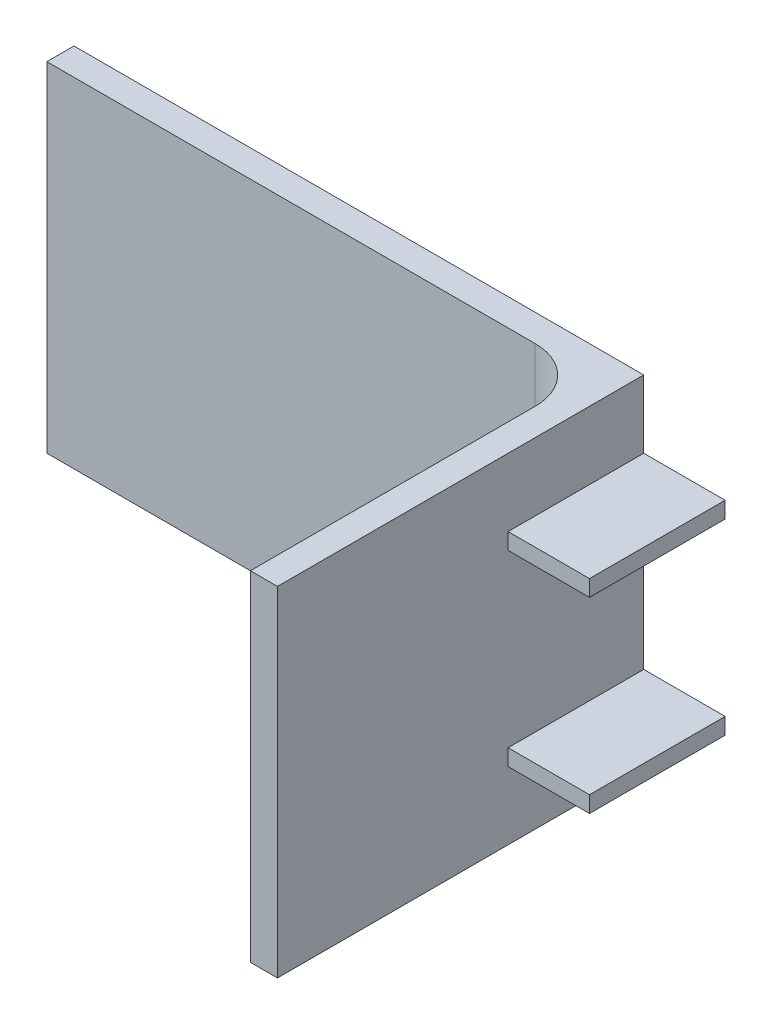
from build123d import *

# Parameters (mm, degrees)
SKETCH1_W           = 42
SKETCH1_H           = 25
BOSS_EXTRUDE1_DEPTH = 2
SKETCH2_W           = 2
SKETCH2_H           = 25
BOSS_EXTRUDE2_DEPTH = 25
SKETCH3_W           = 10
SKETCH3_H           = 1.2
BOSS_EXTRUDE3_DEPTH = 6
FILLET1_R           = 4


with BuildPart() as part:
    # Sketch1 → Boss-Extrude1 (new body)
    with BuildSketch(Plane.XY):
        with Locations((-21, 12.5)):
            Rectangle(SKETCH1_W, SKETCH1_H)
    extrude(amount=BOSS_EXTRUDE1_DEPTH)

    # Sketch2 → Boss-Extrude2 (add)
    with BuildSketch(Plane.XY.offset(2)):
        with Locations((-1, 12.5)):
            Rectangle(SKETCH2_W, SKETCH2_H)
    extrude(amount=BOSS_EXTRUDE2_DEPTH)

    # Sketch3 → Boss-Extrude3 (add)
    with BuildSketch(Plane(origin=(0, 0, 0), x_dir=(0, 0, -1), z_dir=(1, 0, 0))):
        with Locations((-5, 19.4)):
            Rectangle(SKETCH3_W, SKETCH3_H)
        with Locations((-5, 5.6)):
            Rectangle(SKETCH3_W, SKETCH3_H)
    extrude(amount=BOSS_EXTRUDE3_DEPTH)

    # Fillet1
    fillet1_edges = [part.edges().sort_by_distance(p)[0] for p in [
        (-2, 12.5, 2),
    ]]
    fillet(fillet1_edges, radius=FILLET1_R)


solid = part.part
